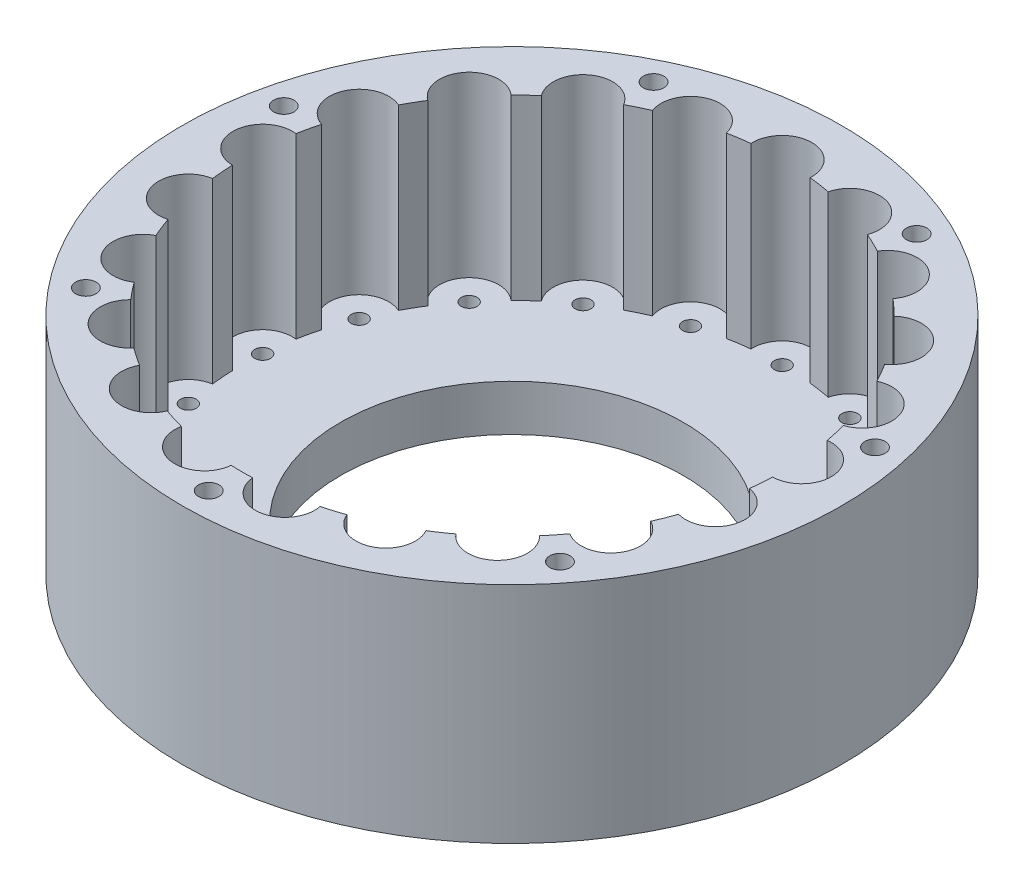
from build123d import *

# Parameters (mm, degrees)
SKIZZE1_R                        = 50
AUFSATZ_LINEAR_AUSTRAGEN1_DEPTH  = 7
SKIZZE2_R                        = 50
SKIZZE2_R_2                      = 41
AUFSATZ_LINEAR_AUSTRAGEN2_DEPTH  = 27
SKIZZE3_R                        = 26
SCHNITT_LINEAR_AUSTRAGEN1_DEPTH  = 27
SKIZZE4_R                        = 4.5
SCHNITT_LINEAR_AUSTRAGEN2_DEPTH  = 27
KREISMUSTER1_COUNT               = 21
F_2_4_2_4_DURCHMESSER_BOHRUNG1_D = 2.4
KREISMUSTER2_COUNT               = 21
F_3_1_3_1_DURCHMESSER_BOHRUNG1_D = 3.1
KREISMUSTER3_COUNT               = 7


with BuildPart() as part:
    # Skizze1 → Aufsatz-Linear austragen1 (new body)
    with BuildSketch(Plane(origin=(0, 0, 0), x_dir=(1, 0, 0), z_dir=(0, 1, 0))):
        with Locations(Location((0, 0, 0), (0, 0, 270))):
            Circle(SKIZZE1_R)
    extrude(amount=AUFSATZ_LINEAR_AUSTRAGEN1_DEPTH)

    # Skizze2 → Aufsatz-Linear austragen2 (add)
    with BuildSketch(Plane(origin=(0, 7, 0), x_dir=(1, 0, 0), z_dir=(0, 1, 0))):
        with Locations(Location((0, 0, 0), (0, 0, 270))):
            Circle(SKIZZE2_R)
        with Locations(Location((0, 0, 0), (0, 0, 270))):
            Circle(SKIZZE2_R_2, mode=Mode.SUBTRACT)
    extrude(amount=AUFSATZ_LINEAR_AUSTRAGEN2_DEPTH)

    # Skizze3 → Schnitt-Linear austragen1 (cut)
    with BuildSketch(Plane(origin=(0, 7, 0), x_dir=(1, 0, 0), z_dir=(0, 1, 0))):
        with Locations(Location((0, 0, 0), (0, 0, 270))):
            Circle(SKIZZE3_R)
    extrude(amount=-SCHNITT_LINEAR_AUSTRAGEN1_DEPTH, mode=Mode.SUBTRACT)

    # Skizze4 → Schnitt-Linear austragen2 (cut)
    with BuildSketch(Plane(origin=(0, 34, 0), x_dir=(1, 0, 0), z_dir=(0, 1, 0))):
        with Locations((0, 41)):
            Circle(SKIZZE4_R)
    schnitt_linear_austragen2 = extrude(amount=-SCHNITT_LINEAR_AUSTRAGEN2_DEPTH, mode=Mode.SUBTRACT)

    # Kreismuster1: Schnitt-Linear austragen2 ×21 about axis
    kreismuster1_axis = Axis((0, 0, 0), (0, 1, 0))
    for i in range(1, KREISMUSTER1_COUNT):
        add(schnitt_linear_austragen2.rotate(kreismuster1_axis, i * 360 / KREISMUSTER1_COUNT), mode=Mode.SUBTRACT)

    # Ø2.4 (2.4) Durchmesser Bohrung1 (through all)
    with Locations(Plane(origin=(0, 7, 0), x_dir=(1, 0, 0), z_dir=(0, 1, 0))):
        with Locations((0, 41)):
            f_2_4_2_4_durchmesser_bohrung1 = Hole(F_2_4_2_4_DURCHMESSER_BOHRUNG1_D / 2)

    # Kreismuster2: Ø2.4 (2.4) Durchmesser Bohrung1 ×21 about axis
    kreismuster2_axis = Axis((0, 0, 0), (0, 1, 0))
    for i in range(1, KREISMUSTER2_COUNT):
        add(f_2_4_2_4_durchmesser_bohrung1.rotate(kreismuster2_axis, i * 360 / KREISMUSTER2_COUNT), mode=Mode.SUBTRACT)

    # Ø3.1 (3.1) Durchmesser Bohrung1 (through all)
    with Locations(Plane(origin=(0, 34, 0), x_dir=(1, 0, 0), z_dir=(0, 1, 0))):
        with Locations((0, -46)):
            f_3_1_3_1_durchmesser_bohrung1 = Hole(F_3_1_3_1_DURCHMESSER_BOHRUNG1_D / 2)

    # Kreismuster3: Ø3.1 (3.1) Durchmesser Bohrung1 ×7 about axis
    kreismuster3_axis = Axis((0, 0, 0), (0, 1, 0))
    for i in range(1, KREISMUSTER3_COUNT):
        add(f_3_1_3_1_durchmesser_bohrung1.rotate(kreismuster3_axis, i * 360 / KREISMUSTER3_COUNT), mode=Mode.SUBTRACT)


solid = part.part
